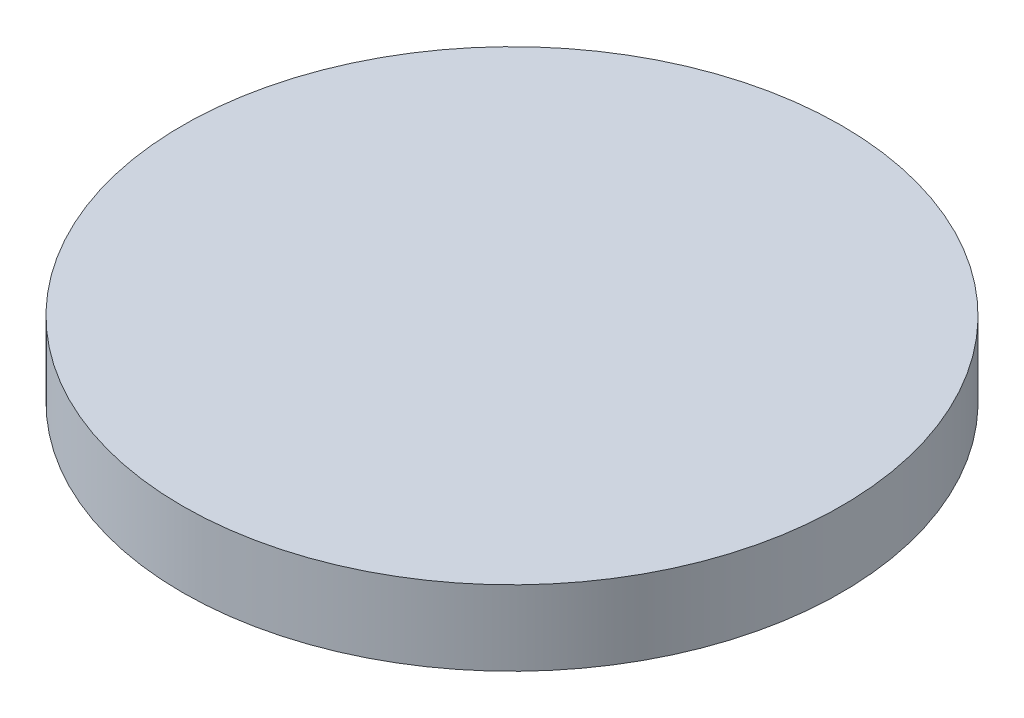
from build123d import *

# Parameters (mm, degrees)
SKETCH1_R           = 13.97
BOSS_EXTRUDE1_DEPTH = 3.175


with BuildPart() as part:
    # Sketch1 → Boss-Extrude1 (new body)
    with BuildSketch(Plane(origin=(0, 0, 0), x_dir=(1, 0, 0), z_dir=(0, 1, 0))):
        with Locations(Location((0, 0, 0), (0, 0, 270))):
            Circle(SKETCH1_R)
    extrude(amount=BOSS_EXTRUDE1_DEPTH)


solid = part.part
